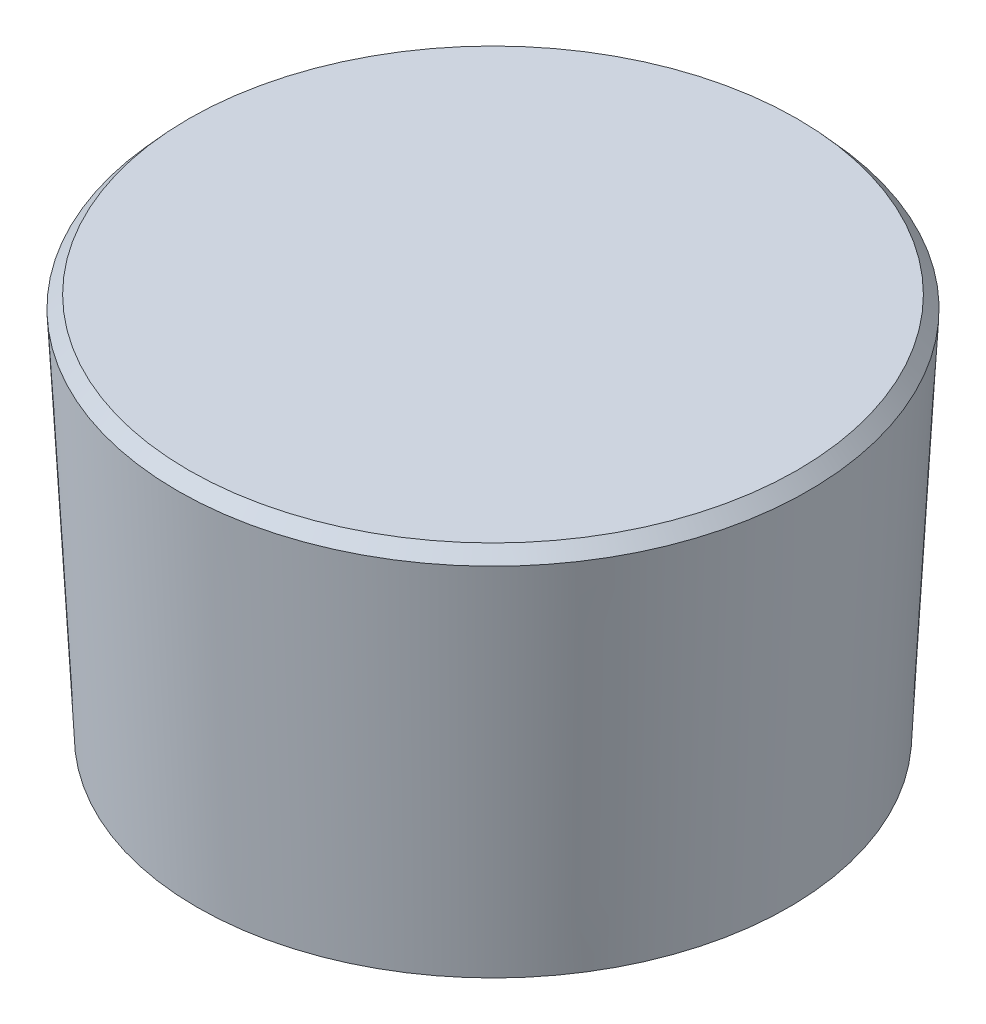
from build123d import *

# Parameters (mm, degrees)
SKETCH1_R      = 5.122
EXTRUDE1_DEPTH = 6.2
EXTRUDE1_DRAFT = -3
CHAMFER1_SIZE  = 0.2
CHAMFER1_SIZE2 = 0.190301206


with BuildPart() as part:
    # Sketch1 → Extrude1 (with draft: the straight prism first)
    with BuildSketch(Plane(origin=(0, 0, 0), x_dir=(1, 0, 0), z_dir=(0, 1, 0))):
        Circle(SKETCH1_R)
    extrude(amount=-EXTRUDE1_DEPTH)
    # Extrude1: the draft: its side faces are tilted about the plane it starts from
    extrude1_sides = [part.faces().sort_by_distance(p)[0] for p in [
        (-5.122, -3.1, 0),
    ]]
    draft(extrude1_sides, Plane(origin=(0, 0, 0), x_dir=(1, 0, 0), z_dir=(0, 1, 0)), EXTRUDE1_DRAFT)

    # Chamfer1
    chamfer1_edges = [part.edges().sort_by_distance(p)[0] for p in [
        (-5.122, 0, 0),
    ]]
    chamfer1_side = [part.faces().sort_by_distance(p)[0] for p in [
        (-4.959535884, -3.1, 0),
    ]]
    chamfer(chamfer1_edges, length=CHAMFER1_SIZE, length2=CHAMFER1_SIZE2, reference=chamfer1_side[0])


solid = part.part
